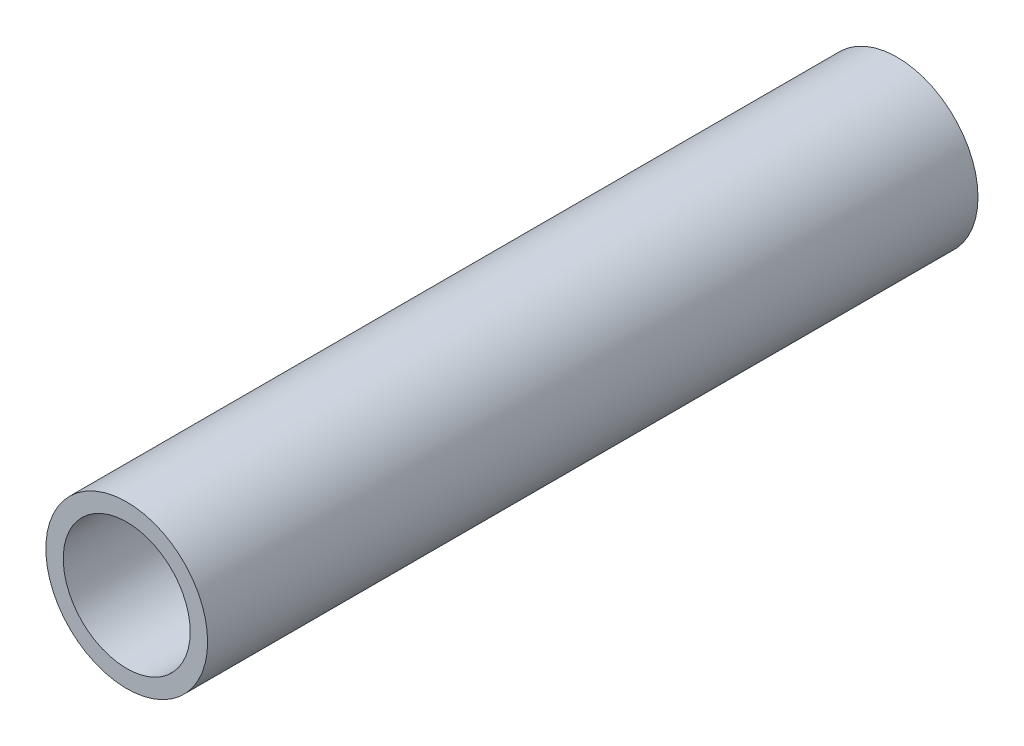
from build123d import *

# Parameters (mm, degrees)
SKETCH1_R           = 13.335
SKETCH1_R_2         = 10.4648
BOSS_EXTRUDE1_DEPTH = 127


with BuildPart() as part:
    # Sketch1 → Boss-Extrude1 (new body)
    with BuildSketch(Plane.XY):
        Circle(SKETCH1_R)
        Circle(SKETCH1_R_2, mode=Mode.SUBTRACT)
    extrude(amount=BOSS_EXTRUDE1_DEPTH)


solid = part.part
